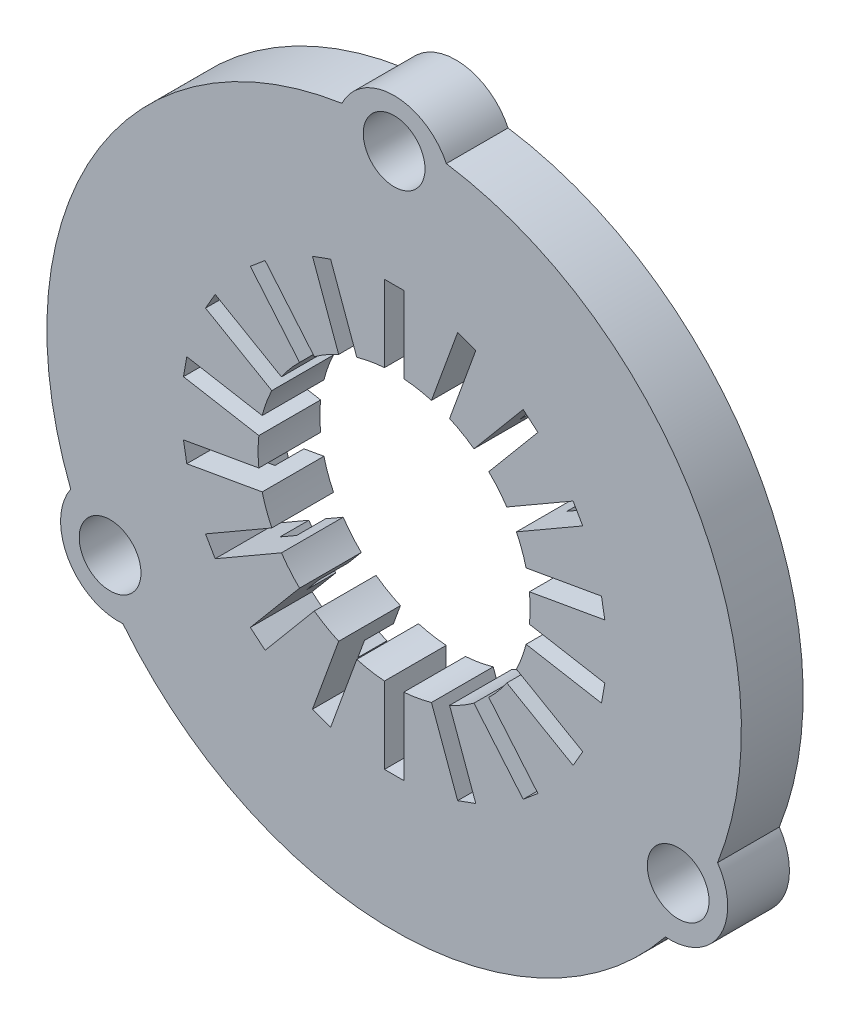
from build123d import *

# Parameters (mm, degrees)
SKETCH_1_R               = 7.05
EXTRUDE_1_DEPTH          = 3.2
SKETCH_2_R               = 1.6
CUT_EXTRUDE_1_DEPTH      = 10
CUT_EXTRUDE_START        = 27.729945754
CUT_EXTRUDE_3_DEPTH      = 31.729945754
PATTERN_CIRCULAR_1_COUNT = 18
SKETCH_4_R               = 9.1
SKETCH_4_R_2             = 8.1
CUT_EXTRUDE_4_DEPTH      = 1.5


with BuildPart() as part:
    # 草图1 → 凸台-拉伸1 (new body)
    with BuildSketch(Plane.XY):
        with BuildLine():
            ThreePointArc((-14.058374697, -11.241089844), (0, -18), (14.058374697, -11.241089844))
            ThreePointArc((14.058374697, -11.241089844), (16.887495374, -9.75), (16.76425672, -6.554364701))
            ThreePointArc((16.76425672, -6.554364701), (15.588457268, 9), (2.705882023, 17.795454545))
            ThreePointArc((2.705882023, 17.795454545), (0, 19.5), (-2.705882023, 17.795454545))
            ThreePointArc((-2.705882023, 17.795454545), (-15.588457268, 9), (-16.76425672, -6.554364701))
            ThreePointArc((-16.76425672, -6.554364701), (-16.887495374, -9.75), (-14.058374697, -11.241089844))
        make_face()
        Circle(SKETCH_1_R, mode=Mode.SUBTRACT)
    extrude(amount=EXTRUDE_1_DEPTH)

    # 草图2 → 切除-拉伸1 (cut)
    with BuildSketch(Plane.XY.offset(3.2)):
        with Locations((0, 17)):
            Circle(SKETCH_2_R)
        with Locations((14.722431864, -8.5)):
            Circle(SKETCH_2_R)
        with Locations((-14.722431864, -8.5)):
            Circle(SKETCH_2_R)
    extrude(amount=-CUT_EXTRUDE_1_DEPTH, mode=Mode.SUBTRACT)

    # 草图3 → 切除-拉伸3 (cut)
    with BuildSketch(Plane(origin=(0, 0, 0), x_dir=(-1, 0, 0), z_dir=(0, 0, -1)).offset(CUT_EXTRUDE_START)):
        with BuildLine():
            ThreePointArc((-0.5, 7.032247152), (0, 7.05), (0.5, 7.032247152))
            Line((0.5, 7.032247152), (0.5, 11))
            Line((0.5, 11), (-0.5, 11))
            Line((-0.5, 11), (-0.5, 7.032247152))
        make_face()
    cut_extrude_3 = extrude(amount=-CUT_EXTRUDE_3_DEPTH, mode=Mode.SUBTRACT)

    # 阵列(圆周)1: 切除-拉伸3 ×18 about axis
    pattern_circular_1_axis = Axis((0, 0, 0), (0, 0, 1))
    for i in range(1, PATTERN_CIRCULAR_1_COUNT):
        add(cut_extrude_3.rotate(pattern_circular_1_axis, i * 360 / PATTERN_CIRCULAR_1_COUNT), mode=Mode.SUBTRACT)

    # 草图4 → 切除-拉伸4 (cut)
    with BuildSketch(Plane(origin=(0, 0, 0), x_dir=(-1, 0, 0), z_dir=(0, 0, -1))):
        Circle(SKETCH_4_R)
        Circle(SKETCH_4_R_2, mode=Mode.SUBTRACT)
    extrude(amount=-CUT_EXTRUDE_4_DEPTH, mode=Mode.SUBTRACT)


solid = part.part
